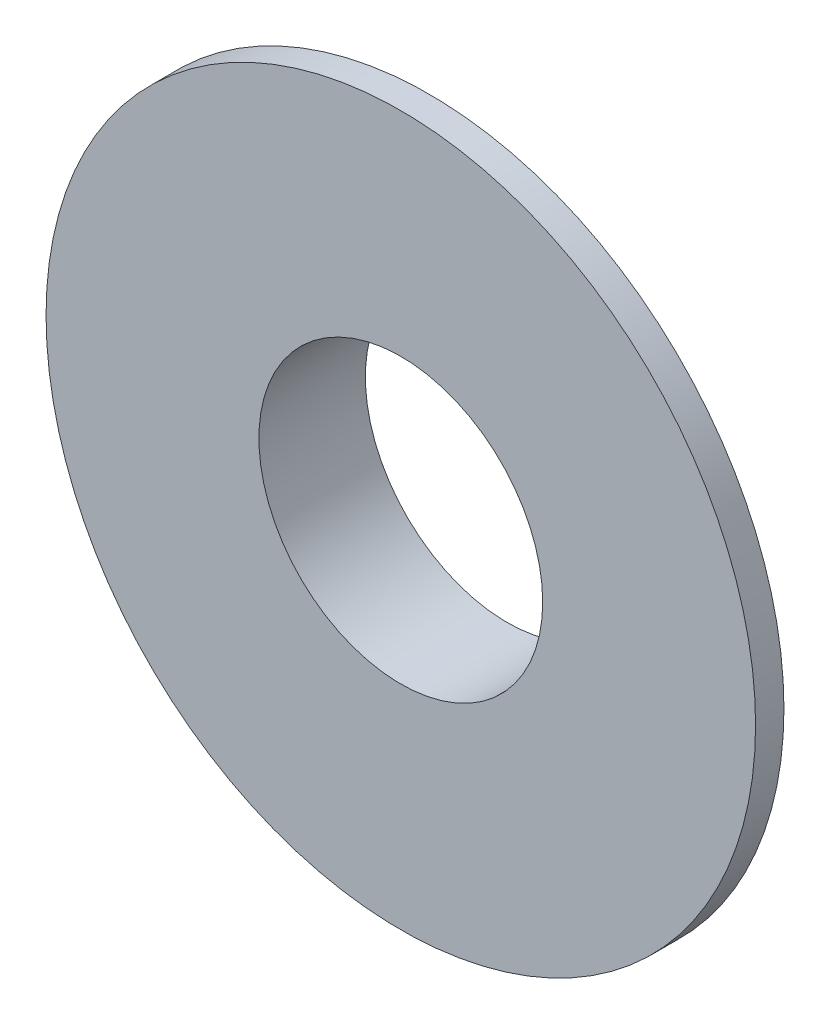
from build123d import *


with BuildPart() as part:
    # Sketch1 → Revolve1 (revolve)
    with BuildSketch(Plane(origin=(0, 0, 0), x_dir=(1, 0, 0), z_dir=(0, 1, 0)), mode=Mode.PRIVATE) as revolve1_sk:
        with BuildLine():
            Line((-4, 3), (-4, 0))
            Line((-4, 0), (-10, 0))
            Line((-10, 0), (-10, 0.8))
            Line((-10, 0.8), (-7.412844257, 1.026346798))
            ThreePointArc((-7.412844257, 1.026346798), (-6.762722663, 1.346951289), (-6.5, 2.022541496))
            Line((-6.5, 2.022541496), (-6.5, 3))
            Line((-6.5, 3), (-4, 3))
        make_face()
    revolve(revolve1_sk.sketch.rotate(Axis((0, 0, 0), (0, 0, -1)), 180), axis=Axis((0, 0, 0), (0, 0, -1)))


solid = part.part
